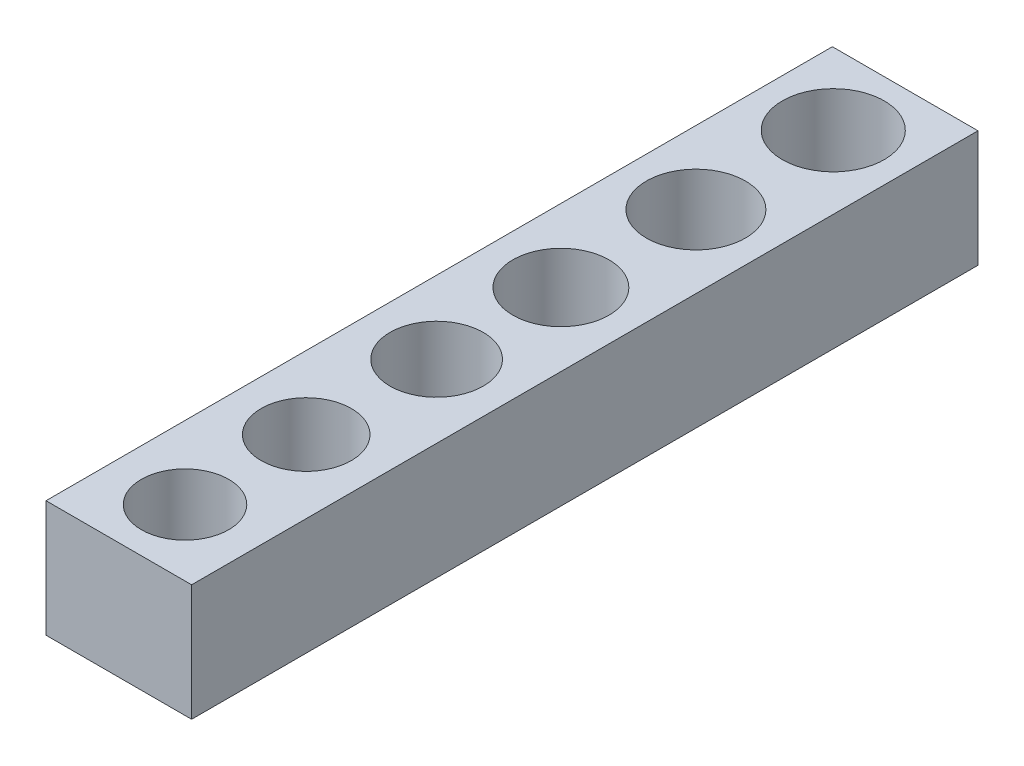
from build123d import *

# Parameters (mm, degrees)
CROQUIS3_W              = 10
CROQUIS3_H              = 54
CROQUIS3_R              = 3.1
CROQUIS3_R_2            = 3.3
CROQUIS3_R_3            = 3.4
CROQUIS3_R_4            = 3.5
CROQUIS3_R_5            = 3
CROQUIS3_R_6            = 3.2
SALIENTE_EXTRUIR1_DEPTH = 8


with BuildPart() as part:
    # Croquis3 → Saliente-Extruir1 (new body)
    with BuildSketch(Plane(origin=(0, 0, 0), x_dir=(1, 0, 0), z_dir=(0, 1, 0))):
        with Locations((0, -2)):
            Rectangle(CROQUIS3_W, CROQUIS3_H)
        with Locations(Location((0, -16.130741571, 0), (0, 0, 270))):
            Circle(CROQUIS3_R, mode=Mode.SUBTRACT)
        with Locations(Location((0, 1.358816273, 0), (0, 0, 270))):
            Circle(CROQUIS3_R_2, mode=Mode.SUBTRACT)
        with Locations(Location((0, 10.630389106, 0), (0, 0, 270))):
            Circle(CROQUIS3_R_3, mode=Mode.SUBTRACT)
        with Locations(Location((0, 20.061315879, 0), (0, 0, 270))):
            Circle(CROQUIS3_R_4, mode=Mode.SUBTRACT)
        with Locations(Location((0, -24.454085364, 0), (0, 0, 270))):
            Circle(CROQUIS3_R_5, mode=Mode.SUBTRACT)
        with Locations(Location((0, -7.175245084, 0), (0, 0, 270))):
            Circle(CROQUIS3_R_6, mode=Mode.SUBTRACT)
    extrude(amount=SALIENTE_EXTRUIR1_DEPTH)


solid = part.part
